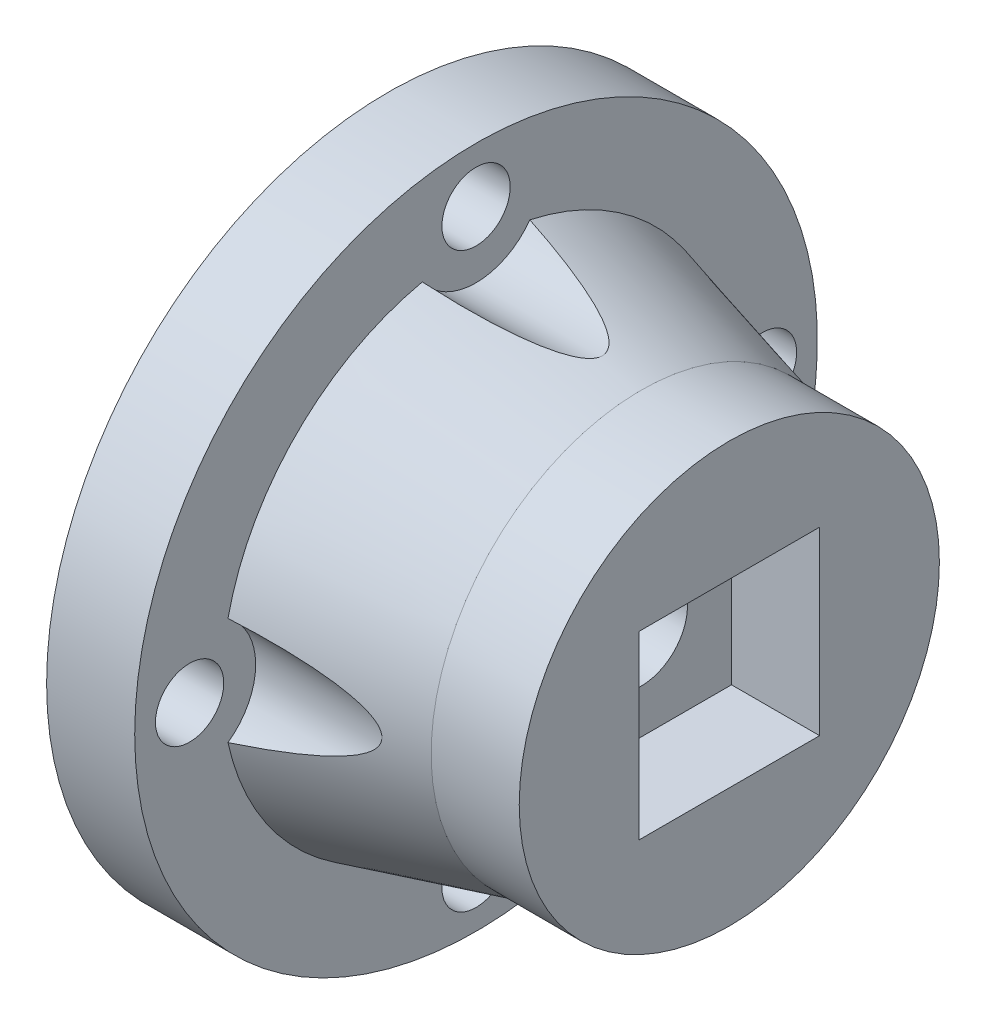
from build123d import *

# Parameters (mm, degrees)
ESQUISSE2_R                  = 9.539549542
ESQUISSE2_W                  = 8.2
ESQUISSE2_H                  = 8.2
BOSS_EXTRU_1_DEPTH           = 4
ESQUISSE3_R                  = 1.55
ENL_V_MAT_EXTRU_1_DEPTH      = 25.753787589
ESQUISSE4_R                  = 3
ENL_V_MAT_EXTRU_2_DEPTH      = 25.753787589
R_P_TITION_CIRCULAIRE1_COUNT = 4


with BuildPart() as part:
    # Esquisse1 → Révolution1 (revolve)
    with BuildSketch(Plane.XY, mode=Mode.PRIVATE) as r_volution1_sk:
        Polygon((1.5, 15.5), (1.5, 10.514205948), (11, 8), (11, 5), (7, 5), (7, 2.1), (13, 2.1), (13, 9.539549542), (5.5, 11.524448975), (5.5, 15.5), align=None)
    revolve(r_volution1_sk.sketch.rotate(Axis((0, 0, 0), (1, 0, 0)), 90), axis=Axis((0, 0, 0), (1, 0, 0)))

    # Esquisse2 → Boss.-Extru.1 (add)
    with BuildSketch(Plane(origin=(13, 0, 0), x_dir=(0, 0, -1), z_dir=(1, 0, 0))):
        Circle(ESQUISSE2_R)
        Rectangle(ESQUISSE2_W, ESQUISSE2_H, mode=Mode.SUBTRACT)
    extrude(amount=BOSS_EXTRU_1_DEPTH)

    # Esquisse3 → Enlèv. mat.-Extru.1 (cut, through all)
    with BuildSketch(Plane(origin=(5.5, 0, 0), x_dir=(0, 0, -1), z_dir=(1, 0, 0))):
        with Locations((0, 13.007102974)):
            Circle(ESQUISSE3_R)
    enl_v_mat_extru_1 = extrude(amount=-ENL_V_MAT_EXTRU_1_DEPTH, mode=Mode.SUBTRACT)

    # Esquisse4 → Enlèv. mat.-Extru.2 (cut, through all)
    with BuildSketch(Plane(origin=(5.5, 0, 0), x_dir=(0, 0, -1), z_dir=(1, 0, 0))):
        with Locations((0, 13.007102974)):
            Circle(ESQUISSE4_R)
    enl_v_mat_extru_2 = extrude(amount=ENL_V_MAT_EXTRU_2_DEPTH, mode=Mode.SUBTRACT)

    # Répétition circulaire1: Enlèv. mat.-Extru.1, Enlèv. mat.-Extru.2 ×4 about axis
    r_p_tition_circulaire1_axis = Axis((0, 0, 0), (1, 0, 0))
    add([enl_v_mat_extru_1.rotate(r_p_tition_circulaire1_axis, i * 360 / R_P_TITION_CIRCULAIRE1_COUNT) for i in range(1, R_P_TITION_CIRCULAIRE1_COUNT)], mode=Mode.SUBTRACT)
    add([enl_v_mat_extru_2.rotate(r_p_tition_circulaire1_axis, i * 360 / R_P_TITION_CIRCULAIRE1_COUNT) for i in range(1, R_P_TITION_CIRCULAIRE1_COUNT)], mode=Mode.SUBTRACT)


solid = part.part
